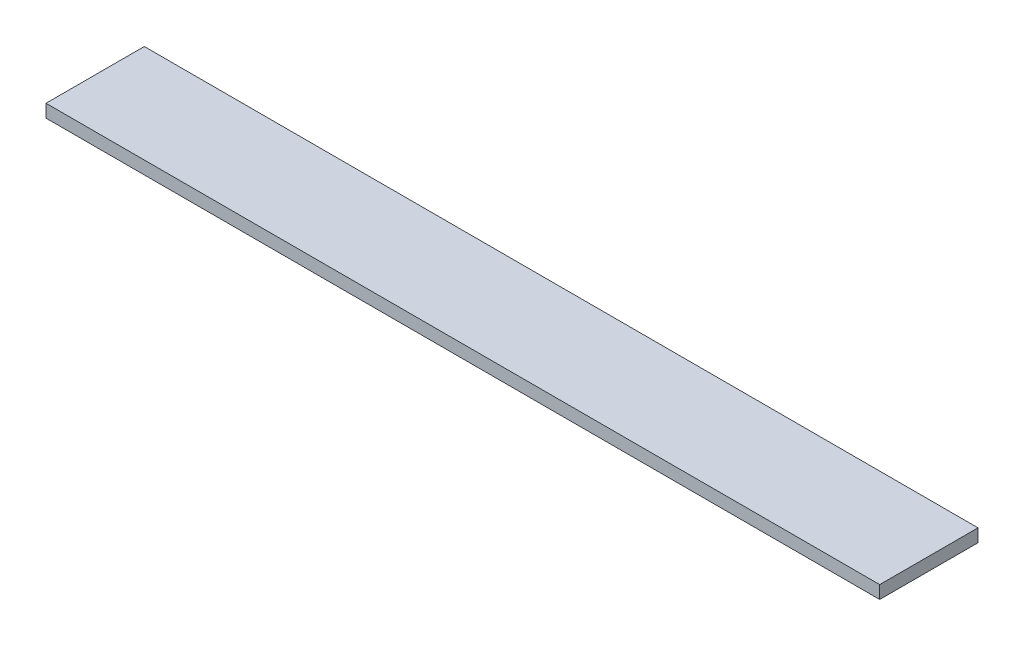
from build123d import *

# Parameters (mm, degrees)
SKETCH3_W           = 645
SKETCH3_H           = 76.047215106
BOSS_EXTRUDE1_DEPTH = 10


with BuildPart() as part:
    # Sketch3 → Boss-Extrude1 (new body)
    with BuildSketch(Plane(origin=(0, 0, 0), x_dir=(1, 0, 0), z_dir=(0, 1, 0))):
        Rectangle(SKETCH3_W, SKETCH3_H)
    extrude(amount=BOSS_EXTRUDE1_DEPTH)


solid = part.part
